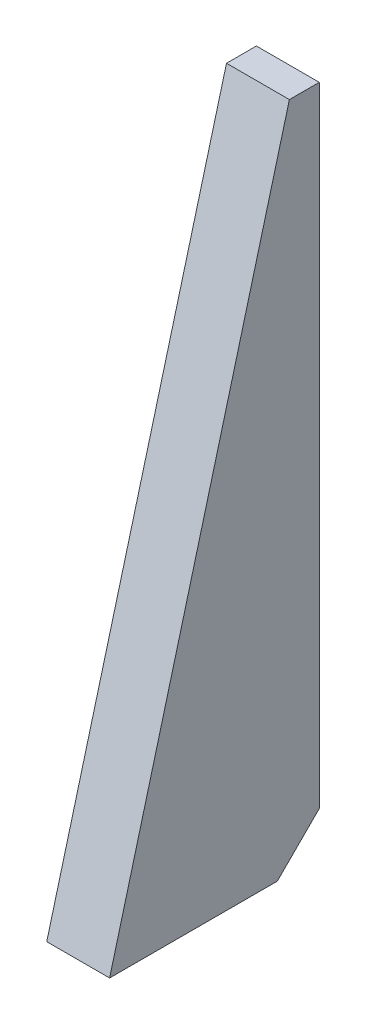
from build123d import *

# Parameters (mm, degrees)
BOSS_EXTRUDE1_DEPTH = 15
CHAMFER1_SIZE       = 10


with BuildPart() as part:
    # Sketch1 → Boss-Extrude1 (new body)
    with BuildSketch(Plane(origin=(0, 0, 0), x_dir=(0, 0, -1), z_dir=(1, 0, 0))):
        Polygon((0, 0), (50, 0), (50, 160), (42.871870789, 160), align=None)
    extrude(amount=BOSS_EXTRUDE1_DEPTH)

    # Chamfer1
    chamfer1_edges = [part.edges().sort_by_distance(p)[0] for p in [
        (7.5, 0, -50),
    ]]
    chamfer(chamfer1_edges, length=CHAMFER1_SIZE)


solid = part.part
